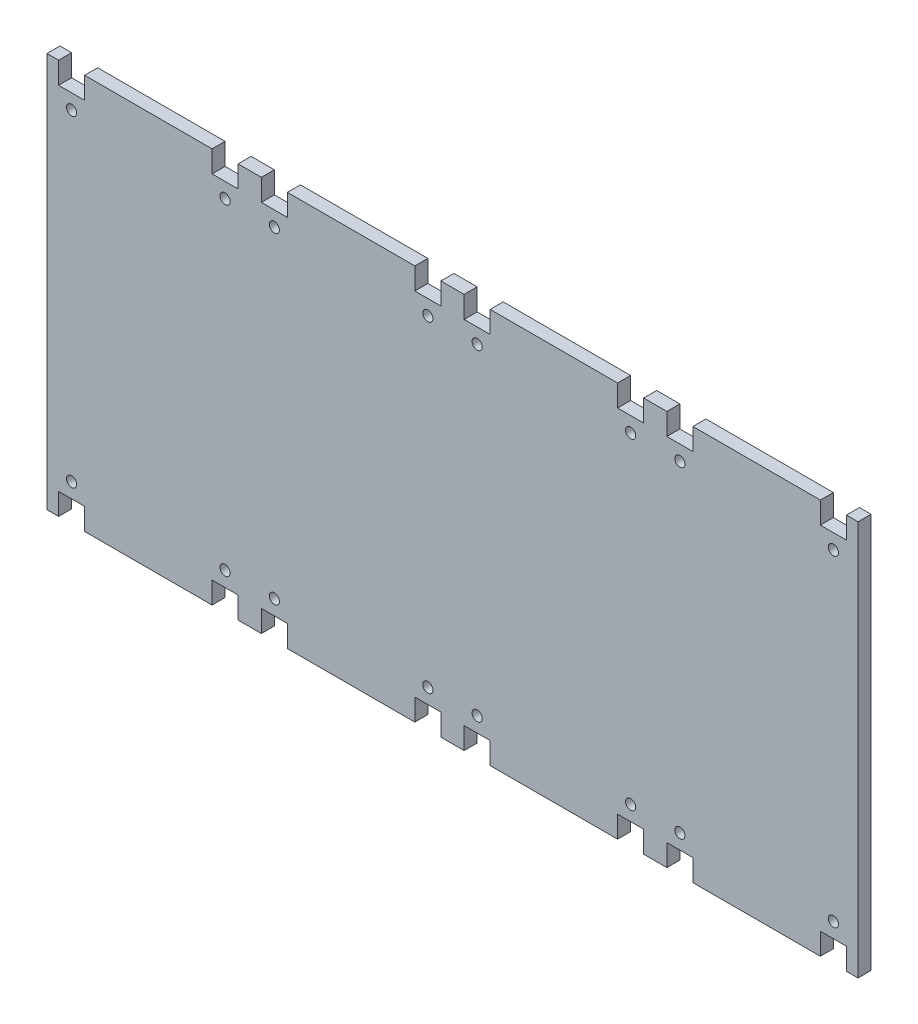
from build123d import *

# Parameters (mm, degrees)
SKETCH1_R           = 1.168758958
BOSS_EXTRUDE1_DEPTH = 3


with BuildPart() as part:
    # Sketch1 → Boss-Extrude1 (new body)
    # profile 1 of 4: a face of its own
    with BuildSketch(Plane.XY):
        Polygon((26.025, 45.5), (23.35, 45.5), (23.35, -45.5), (26.025, -45.5), (26.025, -40.5), (32.025, -40.5), (32.025, -45.5), (61.375, -45.5), (61.375, -40.5), (67.375, -40.5), (67.375, -45.5), (70.05, -45.5), (70.05, 45.5), (67.375, 45.5), (67.375, 40.5), (61.375, 40.5), (61.375, 45.5), (32.025, 45.5), (32.025, 40.5), (26.025, 40.5), align=None)
        with Locations((29.025, -37.05)):
            Circle(SKETCH1_R, mode=Mode.SUBTRACT)
        with Locations((64.375, -37.05)):
            Circle(SKETCH1_R, mode=Mode.SUBTRACT)
        with Locations((29.025, 37.05)):
            Circle(SKETCH1_R, mode=Mode.SUBTRACT)
        with Locations((64.375, 37.05)):
            Circle(SKETCH1_R, mode=Mode.SUBTRACT)
    # profile 2 of 4: a face of its own
    with BuildSketch(Plane.XY):
        Polygon((-20.675, 45.5), (-23.35, 45.5), (-23.35, -45.5), (-20.675, -45.5), (-20.675, -40.5), (-14.675, -40.5), (-14.675, -45.5), (14.675, -45.5), (14.675, -40.5), (20.675, -40.5), (20.675, -45.5), (23.35, -45.5), (23.35, 45.5), (20.675, 45.5), (20.675, 40.5), (14.675, 40.5), (14.675, 45.5), (-14.675, 45.5), (-14.675, 40.5), (-20.675, 40.5), align=None)
        with Locations((-17.675, -37.05)):
            Circle(SKETCH1_R, mode=Mode.SUBTRACT)
        with Locations((17.675, -37.05)):
            Circle(SKETCH1_R, mode=Mode.SUBTRACT)
        with Locations((-17.675, 37.05)):
            Circle(SKETCH1_R, mode=Mode.SUBTRACT)
        with Locations((17.675, 37.05)):
            Circle(SKETCH1_R, mode=Mode.SUBTRACT)
    # profile 3 of 4: a face of its own
    with BuildSketch(Plane.XY):
        Polygon((72.725, 45.5), (70.05, 45.5), (70.05, -45.5), (72.725, -45.5), (72.725, -40.5), (78.725, -40.5), (78.725, -45.5), (108.075, -45.5), (108.075, -40.5), (114.075, -40.5), (114.075, -45.5), (116.75, -45.5), (116.75, 45.5), (114.075, 45.5), (114.075, 40.5), (108.075, 40.5), (108.075, 45.5), (78.725, 45.5), (78.725, 40.5), (72.725, 40.5), align=None)
        with Locations((75.725, -37.05)):
            Circle(SKETCH1_R, mode=Mode.SUBTRACT)
        with Locations((111.075, -37.05)):
            Circle(SKETCH1_R, mode=Mode.SUBTRACT)
        with Locations((75.725, 37.05)):
            Circle(SKETCH1_R, mode=Mode.SUBTRACT)
        with Locations((111.075, 37.05)):
            Circle(SKETCH1_R, mode=Mode.SUBTRACT)
    # profile 4 of 4: a face of its own
    with BuildSketch(Plane.XY):
        Polygon((119.425, 45.5), (116.75, 45.5), (116.75, -45.5), (119.425, -45.5), (119.425, -40.5), (125.425, -40.5), (125.425, -45.5), (154.775, -45.5), (154.775, -40.5), (160.775, -40.5), (160.775, -45.5), (163.45, -45.5), (163.45, 45.5), (160.775, 45.5), (160.775, 40.5), (154.775, 40.5), (154.775, 45.5), (125.425, 45.5), (125.425, 40.5), (119.425, 40.5), align=None)
        with Locations((122.425, -37.05)):
            Circle(SKETCH1_R, mode=Mode.SUBTRACT)
        with Locations((157.775, -37.05)):
            Circle(SKETCH1_R, mode=Mode.SUBTRACT)
        with Locations((122.425, 37.05)):
            Circle(SKETCH1_R, mode=Mode.SUBTRACT)
        with Locations((157.775, 37.05)):
            Circle(SKETCH1_R, mode=Mode.SUBTRACT)
    extrude(amount=BOSS_EXTRUDE1_DEPTH)


solid = part.part
